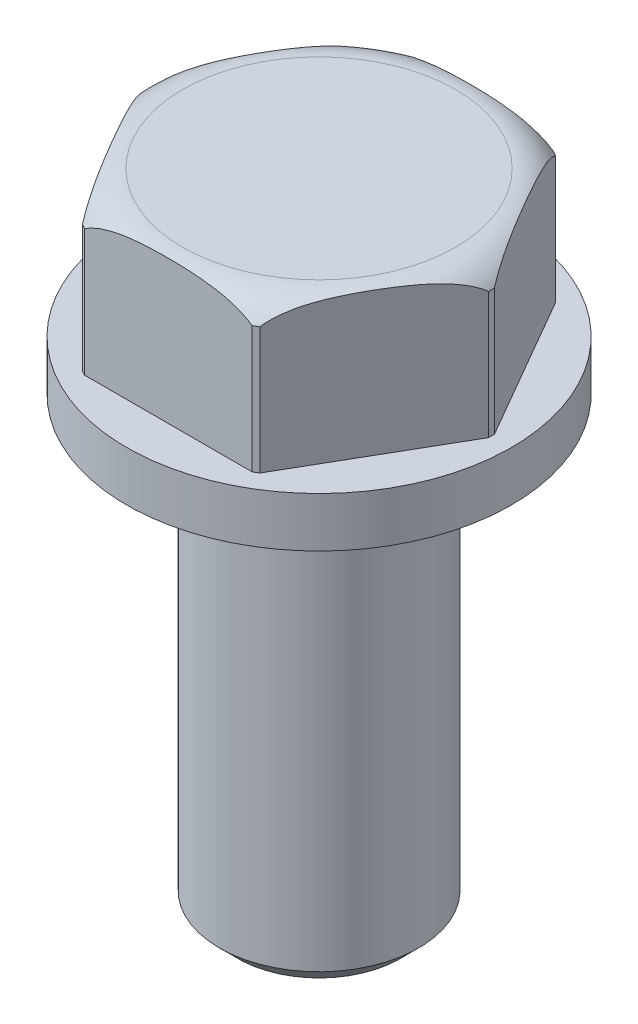
from build123d import *

# Parameters (mm, degrees)
CROQUIS2_W            = 10.668
CROQUIS2_H            = 5.08
CORTAR_EXTRUIR1_DEPTH = 9.271
MATRIZC1_COUNT        = 6
CHAFL_N1_SIZE         = 1.16332


with BuildPart() as part:
    # Croquis1 → Revolución1 (revolve)
    with BuildSketch(Plane.XY, mode=Mode.PRIVATE) as revoluci_n1_sk:
        Polygon((0, 40.9956), (10.9855, 40.9956), (10.9855, 31.7246), (12.2555, 31.7246), (12.2555, 28.5496), (6.35, 28.5496), (6.35, 0), (0, 0), align=None)
    revolve(revoluci_n1_sk.sketch.rotate(Axis((0, 0, 0), (0, 1, 0)), 90), axis=Axis((0, 0, 0), (0, 1, 0)))

    # Croquis2 → Cortar-Extruir1 (cut)
    with BuildSketch(Plane(origin=(0, 40.9956, 0), x_dir=(1, 0, 0), z_dir=(0, 1, 0))):
        with Locations((0, 12.14362714)):
            Rectangle(CROQUIS2_W, CROQUIS2_H)
    cortar_extruir1 = extrude(amount=-CORTAR_EXTRUIR1_DEPTH, mode=Mode.SUBTRACT)

    # MatrizC1: Cortar-Extruir1 ×6 about axis
    matrizc1_axis = Axis((0, 0, 0), (0, 1, 0))
    for i in range(1, MATRIZC1_COUNT):
        add(cortar_extruir1.rotate(matrizc1_axis, i * 360 / MATRIZC1_COUNT), mode=Mode.SUBTRACT)

    # Croquis3 → Cortar-Revolución1 (revolve, cut)
    with BuildSketch(Plane.XY):
        with BuildLine():
            Line((11.176, 39.4716), (11.176, 40.9956))
            Line((11.176, 40.9956), (8.6995, 40.9956))
            ThreePointArc((8.6995, 40.9956), (10.153428149, 40.584076992), (11.176, 39.4716))
        make_face()
    revolve(axis=Axis((0, 31.7246, 0), (0, 1, 0)), mode=Mode.SUBTRACT)

    # Chaflán1
    chafl_n1_edges = [part.edges().sort_by_distance(p)[0] for p in [
        (0, 0, 6.35),
    ]]
    chamfer(chafl_n1_edges, length=CHAFL_N1_SIZE)


solid = part.part
